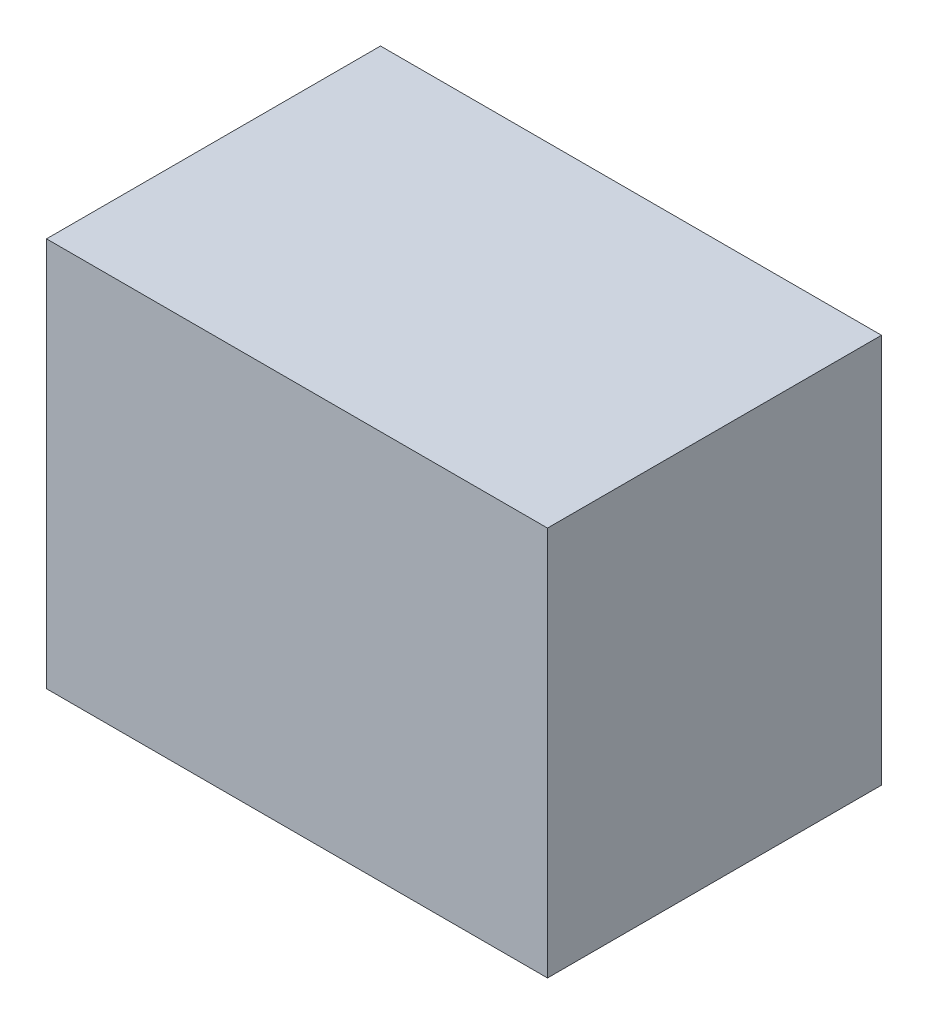
from build123d import *

# Parameters (mm, degrees)
SKETCH_1_W      = 90
SKETCH_1_H      = 70
EXTRUDE_1_DEPTH = 60


with BuildPart() as part:
    # 草图1 → 凸台-拉伸1 (new body)
    with BuildSketch(Plane.XY):
        Rectangle(SKETCH_1_W, SKETCH_1_H)
    extrude(amount=EXTRUDE_1_DEPTH)


solid = part.part
